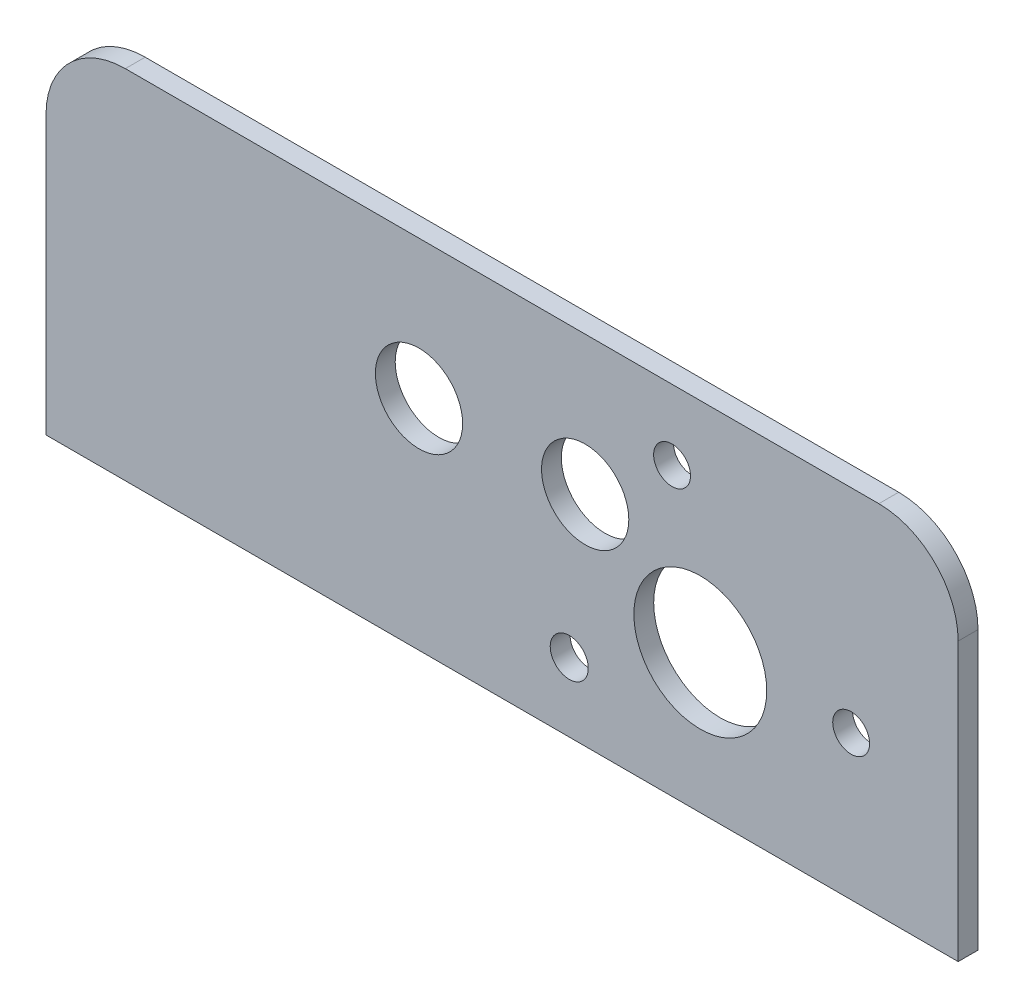
from build123d import *

# Parameters (mm, degrees)
SKETCH1_W           = 230
SKETCH1_H           = 90
BOSS_EXTRUDE1_DEPTH = 5
FILLET1_R           = 20
CUT_EXTRUDE1_REACH  = 125.592
SKETCH2_R           = 11
SKETCH2_R_2         = 16.75
CUT_EXTRUDE2_REACH  = 125.592
SKETCH3_R           = 4.65
SKETCH3_R_2         = 4.8


with BuildPart() as part:
    # Sketch1 → Boss-Extrude1 (new body)
    with BuildSketch(Plane.XY):
        Rectangle(SKETCH1_W, SKETCH1_H)
    extrude(amount=BOSS_EXTRUDE1_DEPTH)

    # Fillet1
    fillet1_edges = [part.edges().sort_by_distance(p)[0] for p in [
        (-115, 45, 2.5),
        (115, 45, 2.5),
    ]]
    fillet(fillet1_edges, radius=FILLET1_R)

    # Sketch2 → Cut-Extrude1 (cut, up to next)
    with BuildSketch(Plane.XY.offset(5), mode=Mode.PRIVATE) as cut_extrude1_sk1:
        with Locations((-20.95, 10)):
            Circle(SKETCH2_R)
    cut_extrude1_tool1 = extrude(cut_extrude1_sk1.sketch, amount=-CUT_EXTRUDE1_REACH, mode=Mode.PRIVATE) & part.part
    # Sketch2 → Cut-Extrude1 (cut, up to next)
    with BuildSketch(Plane.XY.offset(5), mode=Mode.PRIVATE) as cut_extrude1_sk2:
        with Locations((20.95, 10)):
            Circle(SKETCH2_R)
    cut_extrude1_tool2 = extrude(cut_extrude1_sk2.sketch, amount=-CUT_EXTRUDE1_REACH, mode=Mode.PRIVATE) & part.part
    # Sketch2 → Cut-Extrude1 (cut, up to next)
    with BuildSketch(Plane.XY.offset(5), mode=Mode.PRIVATE) as cut_extrude1_sk3:
        with Locations((49.976927154, -10)):
            Circle(SKETCH2_R_2)
    cut_extrude1_tool3 = extrude(cut_extrude1_sk3.sketch, amount=-CUT_EXTRUDE1_REACH, mode=Mode.PRIVATE) & part.part
    add(cut_extrude1_tool1.solids().sort_by_distance((-20.95, 10, 5))[0], mode=Mode.SUBTRACT)
    add(cut_extrude1_tool2.solids().sort_by_distance((20.95, 10, 5))[0], mode=Mode.SUBTRACT)
    add(cut_extrude1_tool3.solids().sort_by_distance((49.976927, -10, 5))[0], mode=Mode.SUBTRACT)

    # Sketch3 → Cut-Extrude2 (cut, up to next)
    with BuildSketch(Plane(origin=(0, 0, 0), x_dir=(-1, 0, 0), z_dir=(0, 0, -1)), mode=Mode.PRIVATE) as cut_extrude2_sk1:
        with Locations((-42.861480484, 27.315297382)):
            Circle(SKETCH3_R)
    cut_extrude2_tool1 = extrude(cut_extrude2_sk1.sketch, amount=-CUT_EXTRUDE2_REACH, mode=Mode.PRIVATE) & part.part
    # Sketch3 → Cut-Extrude2 (cut, up to next)
    with BuildSketch(Plane(origin=(0, 0, 0), x_dir=(-1, 0, 0), z_dir=(0, 0, -1)), mode=Mode.PRIVATE) as cut_extrude2_sk2:
        with Locations((-88.015918911, -8.560303387)):
            Circle(SKETCH3_R)
    cut_extrude2_tool2 = extrude(cut_extrude2_sk2.sketch, amount=-CUT_EXTRUDE2_REACH, mode=Mode.PRIVATE) & part.part
    # Sketch3 → Cut-Extrude2 (cut, up to next)
    with BuildSketch(Plane(origin=(0, 0, 0), x_dir=(-1, 0, 0), z_dir=(0, 0, -1)), mode=Mode.PRIVATE) as cut_extrude2_sk3:
        with Locations((-16.935196723, -27.604446885)):
            Circle(SKETCH3_R_2)
    cut_extrude2_tool3 = extrude(cut_extrude2_sk3.sketch, amount=-CUT_EXTRUDE2_REACH, mode=Mode.PRIVATE) & part.part
    add(cut_extrude2_tool1.solids().sort_by_distance((42.86148, 27.315297, 0))[0], mode=Mode.SUBTRACT)
    add(cut_extrude2_tool2.solids().sort_by_distance((88.015919, -8.560303, 0))[0], mode=Mode.SUBTRACT)
    add(cut_extrude2_tool3.solids().sort_by_distance((16.935197, -27.604447, 0))[0], mode=Mode.SUBTRACT)


solid = part.part
